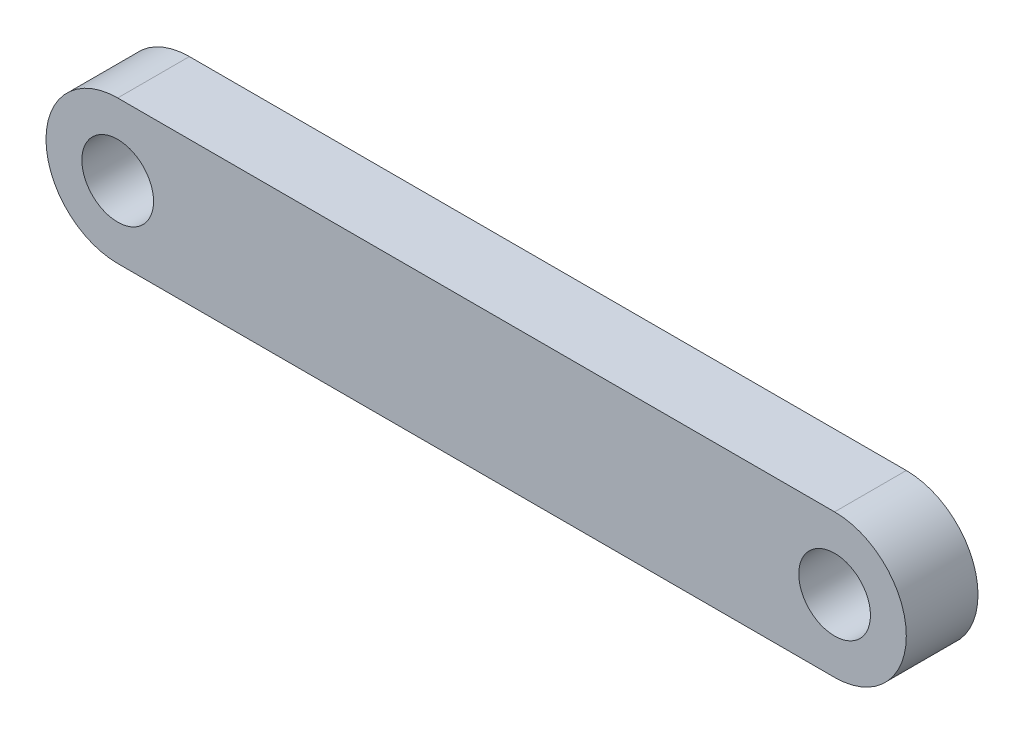
from build123d import *

# Parameters (mm, degrees)
SKETCH1_R          = 5
BASE_EXTRUDE_DEPTH = 5


with BuildPart() as part:
    # Sketch1 → Base-Extrude (new, symmetric)
    with BuildSketch(Plane.XY):
        with BuildLine():
            Line((50, 10), (-50, 10))
            ThreePointArc((-50, 10), (-60, 0), (-50, -10))
            Line((-50, -10), (50, -10))
            ThreePointArc((50, -10), (60, 0), (50, 10))
        make_face()
        with Locations((50, 0)):
            Circle(SKETCH1_R, mode=Mode.SUBTRACT)
        with Locations((-50, 0)):
            Circle(SKETCH1_R, mode=Mode.SUBTRACT)
    extrude(amount=BASE_EXTRUDE_DEPTH, both=True)


solid = part.part
